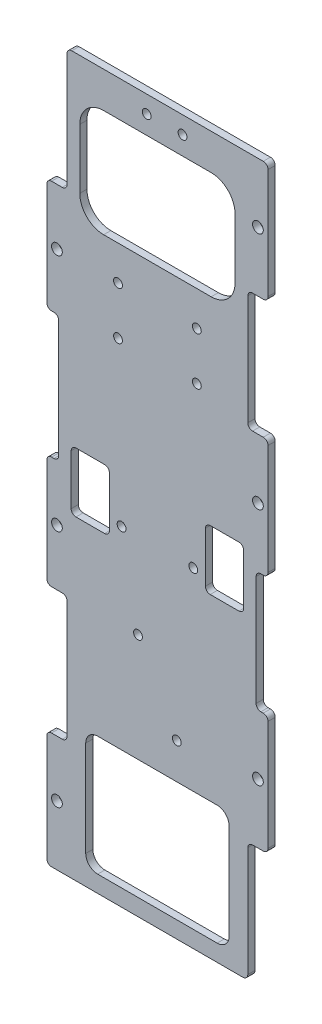
from build123d import *

# Parameters (mm, degrees)
SKETCH1_W           = 92.6
SKETCH1_H           = 300
BOSS_EXTRUDE1_DEPTH = 3
SKETCH3_R           = 2.25
SKETCH3_W           = 8.48
SKETCH3_H           = 51.5
SKETCH3_H_2         = 50
SKETCH3_W_2         = 5
SKETCH3_H_3         = 53
CUT_EXTRUDE2_DEPTH  = 10
FILLET1_R           = 2
SKETCH4_R           = 1.85
CUT_EXTRUDE3_DEPTH  = 5
SKETCH5_R           = 1.85
CUT_EXTRUDE4_DEPTH  = 10
SKETCH6_R           = 1.85
CUT_EXTRUDE5_DEPTH  = 8.5
CUT_EXTRUDE6_DEPTH  = 8.5
SKETCH9_R           = 1.85
CUT_EXTRUDE7_DEPTH  = 10


with BuildPart() as part:
    # Sketch1 → Boss-Extrude1 (new body)
    with BuildSketch(Plane.XY):
        Rectangle(SKETCH1_W, SKETCH1_H)
    extrude(amount=BOSS_EXTRUDE1_DEPTH)

    # Sketch3 → Cut-Extrude2 (cut)
    with BuildSketch(Plane.XY):
        with Locations((-42.06, 75)):
            Circle(SKETCH3_R)
        with Locations((42.06, 125)):
            Circle(SKETCH3_R)
        with Locations((42.06, 25)):
            Circle(SKETCH3_R)
        with Locations((42.06, -75)):
            Circle(SKETCH3_R)
        with Locations((-42.06, -25)):
            Circle(SKETCH3_R)
        with Locations((-42.06, -125)):
            Circle(SKETCH3_R)
        with Locations((-42.06, 124.25)):
            Rectangle(SKETCH3_W, SKETCH3_H)
        with Locations((42.06, 75)):
            Rectangle(SKETCH3_W, SKETCH3_H_2)
        with Locations((43.8, -25)):
            Rectangle(SKETCH3_W_2, SKETCH3_H_2)
        with Locations((-43.8, 25)):
            Rectangle(SKETCH3_W_2, SKETCH3_H_3)
        with Locations((-42.06, -75)):
            Rectangle(SKETCH3_W, SKETCH3_H_3)
        with Locations((42.06, -125)):
            Rectangle(SKETCH3_W, SKETCH3_H_2)
    extrude(amount=CUT_EXTRUDE2_DEPTH, mode=Mode.SUBTRACT)

    # Fillet1
    fillet1_edges = [part.edges().sort_by_distance(p)[0] for p in [
        (46.3, -100, 1.5),
        (37.82, -100, 1.5),
        (37.82, -150, 1.5),
        (46.3, 50, 1.5),
        (46.3, 100, 1.5),
        (37.82, 100, 1.5),
        (37.82, 50, 1.5),
        (-46.3, -48.5, 1.5),
        (-46.3, -101.5, 1.5),
        (-37.82, -101.5, 1.5),
        (-37.82, -48.5, 1.5),
        (41.3, 0, 1.5),
        (41.3, -50, 1.5),
        (46.3, -50, 1.5),
        (46.3, 0, 1.5),
        (46.3, 150, 1.5),
        (-46.3, 51.5, 1.5),
        (-46.3, -150, 1.5),
        (-46.3, -1.5, 1.5),
        (-41.3, -1.5, 1.5),
        (-41.3, 51.5, 1.5),
        (-46.3, 98.5, 1.5),
        (-37.82, 98.5, 1.5),
        (-37.82, 150, 1.5),
    ]]
    fillet(fillet1_edges, radius=FILLET1_R)

    # Sketch4 → Cut-Extrude3 (cut)
    with BuildSketch(Plane(origin=(0, 0, 0), x_dir=(-1, 0, 0), z_dir=(0, 0, -1))):
        with Locations((8.125, -47.8)):
            Circle(SKETCH4_R)
        with Locations((-8.125, -78)):
            Circle(SKETCH4_R)
    extrude(amount=-CUT_EXTRUDE3_DEPTH, mode=Mode.SUBTRACT)

    # Sketch5 → Cut-Extrude4 (cut)
    with BuildSketch(Plane(origin=(0, 0, 0), x_dir=(-1, 0, 0), z_dir=(0, 0, -1))):
        with Locations((-15, -12)):
            Circle(SKETCH5_R)
        with Locations((15, -12)):
            Circle(SKETCH5_R)
        with BuildLine():
            Line((-22.1, -18.1), (-34.1, -18.1))
            ThreePointArc((-34.1, -18.1), (-35.514213562, -17.514213562), (-36.1, -16.1))
            Line((-36.1, -16.1), (-36.1, 4.9))
            ThreePointArc((-36.1, 4.9), (-35.514213562, 6.314213562), (-34.1, 6.9))
            Line((-34.1, 6.9), (-22.1, 6.9))
            ThreePointArc((-22.1, 6.9), (-20.685786438, 6.314213562), (-20.1, 4.9))
            Line((-20.1, 4.9), (-20.1, -16.1))
            ThreePointArc((-20.1, -16.1), (-20.685786438, -17.514213562), (-22.1, -18.1))
        make_face()
        with BuildLine():
            Line((34.1, -18.1), (22.1, -18.1))
            ThreePointArc((22.1, -18.1), (20.685786438, -17.514213562), (20.1, -16.1))
            Line((20.1, -16.1), (20.1, 4.9))
            ThreePointArc((20.1, 4.9), (20.685786438, 6.314213562), (22.1, 6.9))
            Line((22.1, 6.9), (34.1, 6.9))
            ThreePointArc((34.1, 6.9), (35.514213562, 6.314213562), (36.1, 4.9))
            Line((36.1, 4.9), (36.1, -16.1))
            ThreePointArc((36.1, -16.1), (35.514213562, -17.514213562), (34.1, -18.1))
        make_face()
    extrude(amount=-CUT_EXTRUDE4_DEPTH, mode=Mode.SUBTRACT)

    # Sketch6 → Cut-Extrude5 (cut)
    with BuildSketch(Plane(origin=(0, 0, 0), x_dir=(-1, 0, 0), z_dir=(0, 0, -1))):
        with Locations((16.5, 55.5)):
            Circle(SKETCH6_R)
        with Locations((-16.5, 55.5)):
            Circle(SKETCH6_R)
        with Locations((-16.5, 75.5)):
            Circle(SKETCH6_R)
        with Locations((16.5, 75.5)):
            Circle(SKETCH6_R)
    extrude(amount=-CUT_EXTRUDE5_DEPTH, mode=Mode.SUBTRACT)

    # Sketch7 → Cut-Extrude6 (cut)
    with BuildSketch(Plane(origin=(0, 0, 0), x_dir=(-1, 0, 0), z_dir=(0, 0, -1))):
        with BuildLine():
            Line((22.5, 90), (-22.5, 90))
            ThreePointArc((-22.5, 90), (-29.571067812, 92.928932188), (-32.5, 100))
            Line((-32.5, 100), (-32.5, 125))
            ThreePointArc((-32.5, 125), (-29.571067812, 132.071067812), (-22.5, 135))
            Line((-22.5, 135), (22.5, 135))
            ThreePointArc((22.5, 135), (29.571067812, 132.071067812), (32.5, 125))
            Line((32.5, 125), (32.5, 100))
            ThreePointArc((32.5, 100), (29.571067812, 92.928932188), (22.5, 90))
        make_face()
        with BuildLine():
            Line((25, -143), (-25, -143))
            ThreePointArc((-25, -143), (-28.535533906, -141.535533906), (-30, -138))
            Line((-30, -138), (-30, -98))
            ThreePointArc((-30, -98), (-28.535533906, -94.464466094), (-25, -93))
            Line((-25, -93), (25, -93))
            ThreePointArc((25, -93), (28.535533906, -94.464466094), (30, -98))
            Line((30, -98), (30, -138))
            ThreePointArc((30, -138), (28.535533906, -141.535533906), (25, -143))
        make_face()
    extrude(amount=-CUT_EXTRUDE6_DEPTH, mode=Mode.SUBTRACT)

    # Sketch9 → Cut-Extrude7 (cut)
    with BuildSketch(Plane(origin=(0, 0, 0), x_dir=(-1, 0, 0), z_dir=(0, 0, -1))):
        with Locations((-10.5, 142.75)):
            Circle(SKETCH9_R)
        with Locations((4.5, 142.75)):
            Circle(SKETCH9_R)
    extrude(amount=-CUT_EXTRUDE7_DEPTH, mode=Mode.SUBTRACT)


solid = part.part
